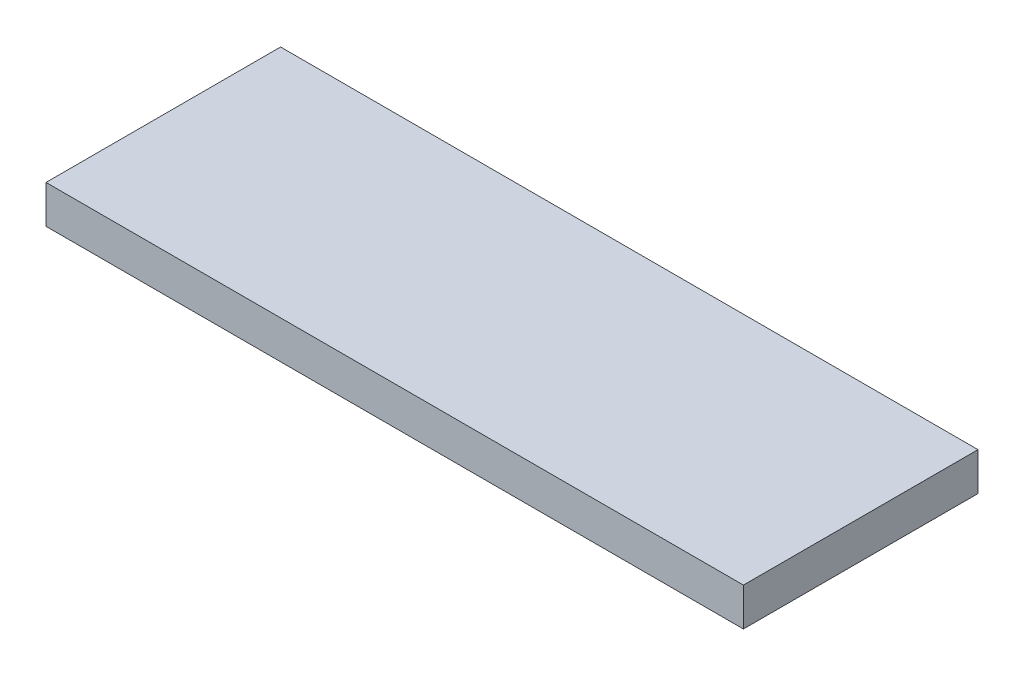
from build123d import *

# Parameters (mm, degrees)
SKETCH1_W           = 110
SKETCH1_H           = 37
BOSS_EXTRUDE1_DEPTH = 6


with BuildPart() as part:
    # Sketch1 → Boss-Extrude1 (new body)
    with BuildSketch(Plane(origin=(0, 0, 0), x_dir=(1, 0, 0), z_dir=(0, 1, 0))):
        with Locations((-40.739130435, 11.630434783)):
            Rectangle(SKETCH1_W, SKETCH1_H)
    extrude(amount=BOSS_EXTRUDE1_DEPTH)


solid = part.part
